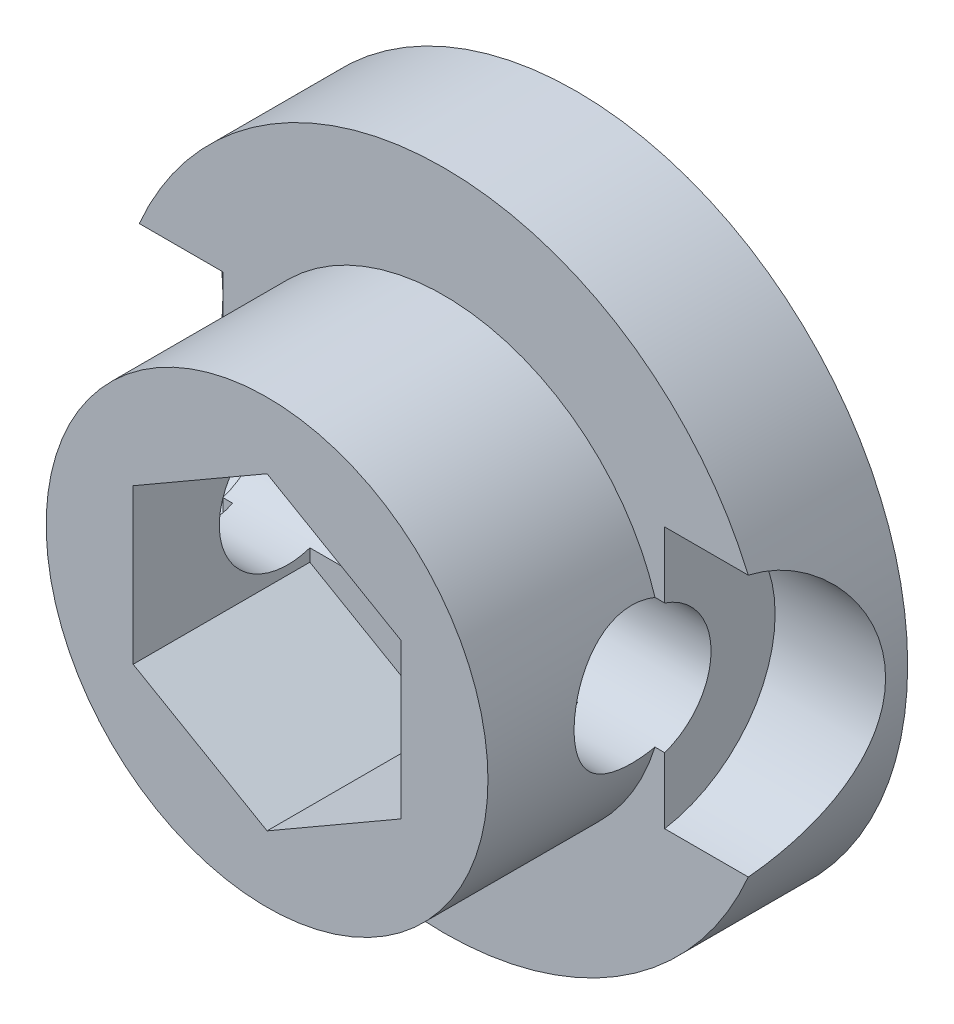
from build123d import *

# Parameters (mm, degrees)
SKETCH1_R               = 5
BOSS_EXTRUDE2_DEPTH     = 7
SKETCH3_R               = 7.5
BOSS_EXTRUDE3_DEPTH     = 3
CUT_EXTRUDE1_DEPTH      = 5
CUT_EXTRUDE1_DEPTH_BACK = 5
SKETCH2_R               = 1.55
SKETCH4_R               = 3
CUT_EXTRUDE2_DEPTH      = 2.5
CUT_EXTRUDE3_START      = -2.5
SKETCH5_R               = 3
CUT_EXTRUDE3_DEPTH      = 2.5


with BuildPart() as part:
    # Sketch1 → Boss-Extrude2 (new body)
    with BuildSketch(Plane.XY):
        Circle(SKETCH1_R)
        Polygon((-3.031088913, 1.75), (0, 3.5), (3.031088913, 1.75), (3.031088913, -1.75), (0, -3.5), (-3.031088913, -1.75), align=None, mode=Mode.SUBTRACT)
    extrude(amount=BOSS_EXTRUDE2_DEPTH)

    # Sketch3 → Boss-Extrude3 (add)
    with BuildSketch(Plane.XY):
        Circle(SKETCH3_R)
    extrude(amount=BOSS_EXTRUDE3_DEPTH)

    # Sketch2 → Cut-Extrude1 (cut, two sides: drawn at the far end of the back side and taken through both)
    with BuildSketch(Plane.ZY.offset(-CUT_EXTRUDE1_DEPTH_BACK)):
        with Locations(Location((3.5, 0, 0), (0, 0, 251.180936631))):
            Circle(SKETCH2_R)
    extrude(amount=CUT_EXTRUDE1_DEPTH + CUT_EXTRUDE1_DEPTH_BACK, mode=Mode.SUBTRACT)

    # Sketch4 → Cut-Extrude2 (cut)
    with BuildSketch(Plane.ZY.offset(5)):
        with Locations((3.5, 0)):
            Circle(SKETCH4_R)
    extrude(amount=CUT_EXTRUDE2_DEPTH, mode=Mode.SUBTRACT)

    # Sketch5 → Cut-Extrude3 (cut)
    with BuildSketch(Plane.ZY.offset(-5).offset(CUT_EXTRUDE3_START)):
        with Locations((3.5, 0)):
            Circle(SKETCH5_R)
    extrude(amount=CUT_EXTRUDE3_DEPTH, mode=Mode.SUBTRACT)


solid = part.part
